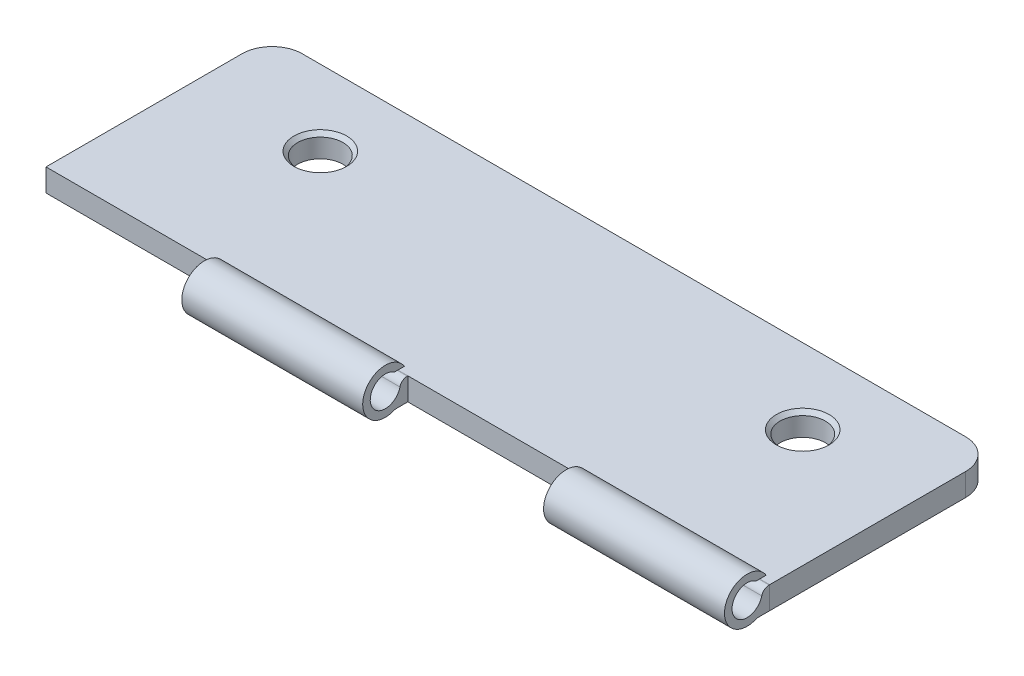
from build123d import *

# Parameters (mm, degrees)
SKETCH1_R           = 1.5
BOSS_EXTRUDE1_DEPTH = 1.5
BOSS_EXTRUDE2_DEPTH = 12
LPATTERN1_COUNT     = 2
LPATTERN1_PITCH     = 24
CHAMFER1_SIZE       = 0.25


with BuildPart() as part:
    # Sketch1 → Boss-Extrude1 (new body)
    with BuildSketch(Plane(origin=(0, 0, 0), x_dir=(1, 0, 0), z_dir=(0, 1, 0))):
        with BuildLine():
            Line((-24, -7.5), (24, -7.5))
            Line((24, -7.5), (24, 5.5))
            ThreePointArc((24, 5.5), (23.414213562, 6.914213562), (22, 7.5))
            Line((22, 7.5), (-22, 7.5))
            ThreePointArc((-22, 7.5), (-23.414213562, 6.914213562), (-24, 5.5))
            Line((-24, 5.5), (-24, -7.5))
        make_face()
        with Locations(Location((-15.803480629, 2.5, 0), (0, 0, 270))):
            Circle(SKETCH1_R, mode=Mode.SUBTRACT)
        with Locations(Location((16.196519371, 2.5, 0), (0, 0, 270))):
            Circle(SKETCH1_R, mode=Mode.SUBTRACT)
    extrude(amount=BOSS_EXTRUDE1_DEPTH)

    # Chamfer1
    chamfer1_edges = [part.edges().sort_by_distance(p)[0] for p in [
        (-15.803480629, 1.5, -4),
        (16.196519371, 1.5, -4),
    ]]
    chamfer(chamfer1_edges, length=CHAMFER1_SIZE)


with BuildPart() as body_2:
    # Sketch2 → Boss-Extrude2 (new body)
    with BuildSketch(Plane(origin=(24, 0, 0), x_dir=(0, 0, -1), z_dir=(1, 0, 0))):
        with BuildLine():
            ThreePointArc((-8.020968355, 1.117799371), (-9.932757452, 1.012054769), (-8.398619051, 2.157715643))
            Line((-8.398619051, 2.157715643), (-7.726693459, 2.157715643))
            ThreePointArc((-7.726693459, 2.157715643), (-10.421413085, 1.810692644), (-8.429112346, -0.036650472))
            ThreePointArc((-8.429112346, -0.036650472), (-8.336931769, -0.009248146), (-8.241210204, 0))
            Line((-8.241210204, 0), (-7.5, 0))
            Line((-7.5, 0), (-7.5, 1.206796223))
            Line((-7.5, 1.206796223), (-7.5, 1.5))
            Line((-7.5, 1.5), (-7.535043146, 1.5))
            ThreePointArc((-7.535043146, 1.5), (-7.844155031, 1.393001072), (-8.020968355, 1.117799371))
        make_face()
    boss_extrude2 = extrude(amount=-BOSS_EXTRUDE2_DEPTH)


with BuildPart() as lpattern1_1:
    # LPattern1: Boss-Extrude2 ×2
    with Locations(*[(-i * LPATTERN1_PITCH, 0, 0) for i in range(1, LPATTERN1_COUNT)]):
        add(boss_extrude2)


solid = Compound([part.part, body_2.part, lpattern1_1.part])
